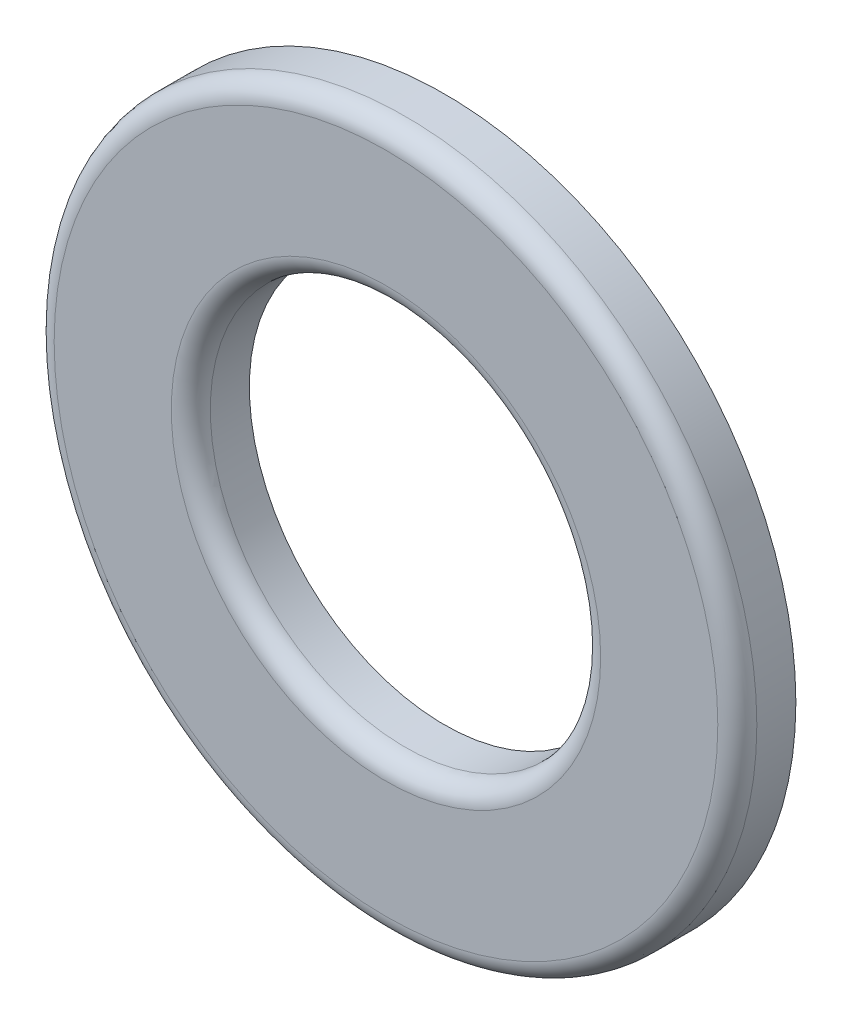
from build123d import *

# Parameters (mm, degrees)
SKETCH1_R           = 4.5
SKETCH1_R_2         = 2.5
BOSS_EXTRUDE1_DEPTH = 0.75
FILLET1_R           = 0.25


with BuildPart() as part:
    # Sketch1 → Boss-Extrude1 (new body)
    with BuildSketch(Plane.XY):
        Circle(SKETCH1_R)
        Circle(SKETCH1_R_2, mode=Mode.SUBTRACT)
    extrude(amount=BOSS_EXTRUDE1_DEPTH)

    # Fillet1
    fillet1_edges = [part.edges().sort_by_distance(p)[0] for p in [
        (-4.5, 0, 0.75),
        (-2.5, 0, 0.75),
    ]]
    fillet(fillet1_edges, radius=FILLET1_R)


solid = part.part
